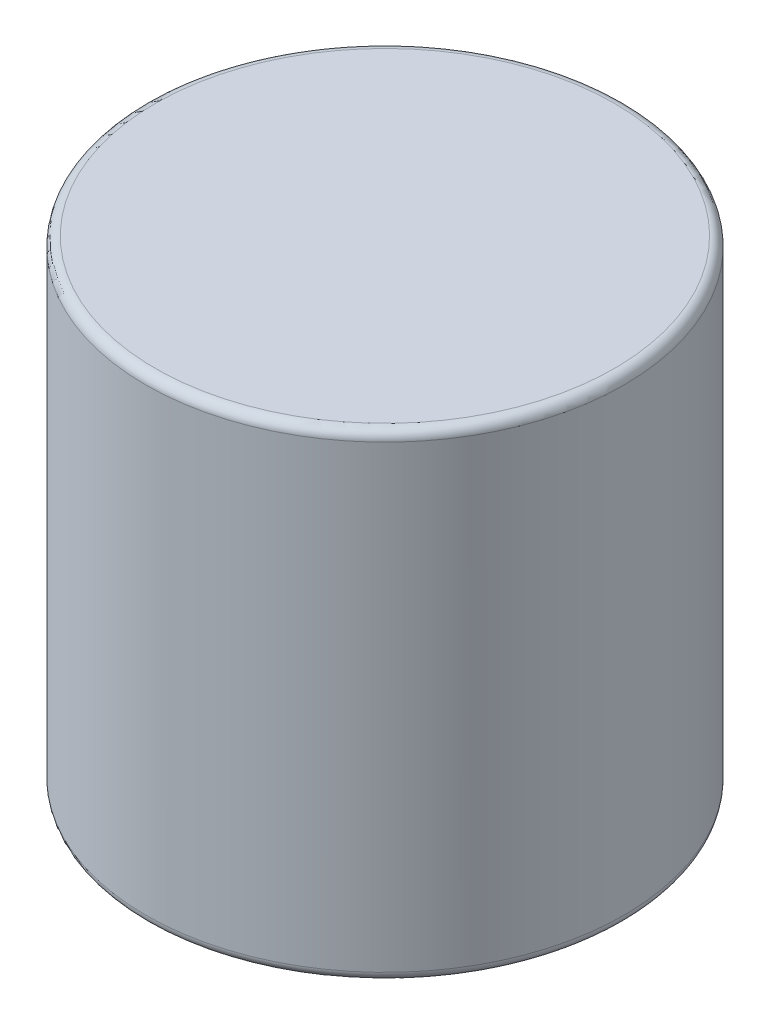
from build123d import *

# Parameters (mm, degrees)
SKETCH_1_W = 2.5
SKETCH_1_H = 5
FILLET_1_R = 0.1


with BuildPart() as part:
    # 草图1 → 旋转2 (revolve)
    with BuildSketch(Plane.XY):
        with Locations((1.25, 0)):
            Rectangle(SKETCH_1_W, SKETCH_1_H)
    revolve(axis=Axis((0, 2.5, 0), (0, -1, 0)))

    # 圆角1
    fillet_1_edges = [part.edges().sort_by_distance(p)[0] for p in [
        (-2.5, -2.5, 0),
        (-2.5, 2.5, 0),
    ]]
    fillet(fillet_1_edges, radius=FILLET_1_R)


solid = part.part
